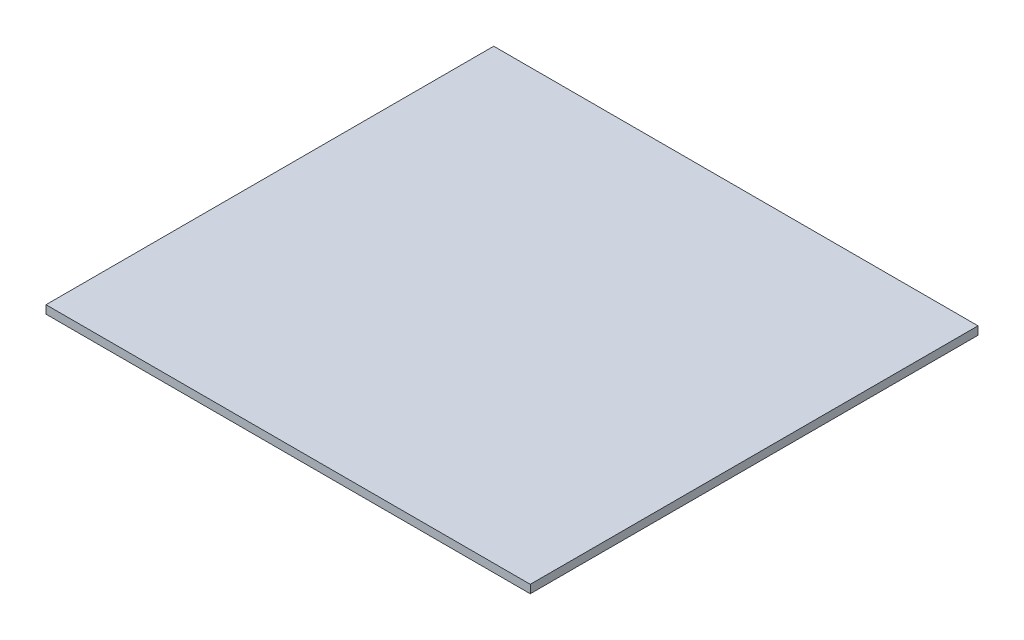
from build123d import *

# Parameters (mm, degrees)
CROQUIS_REPISA_W         = 1060
CROQUIS_REPISA_H         = 980
REPISA_1060X980X18_DEPTH = 18


with BuildPart() as part:
    # Croquis_repisa → Repisa_1060x980x18 (new body)
    with BuildSketch(Plane(origin=(0, 0, 0), x_dir=(1, 0, 0), z_dir=(0, 1, 0))):
        Rectangle(CROQUIS_REPISA_W, CROQUIS_REPISA_H)
    extrude(amount=REPISA_1060X980X18_DEPTH)


solid = part.part
